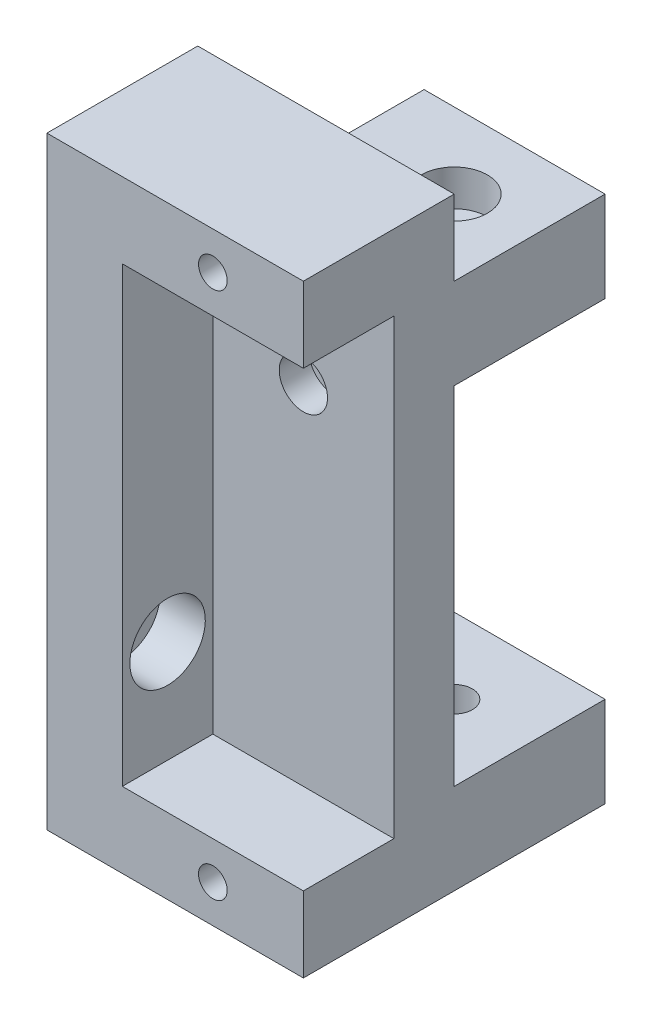
from build123d import *

# Parameters (mm, degrees)
ESQUISSE1_W                                       = 12
ESQUISSE1_H                                       = 40
BOSS_EXTRU_1_DEPTH                                = 4
ESQUISSE2_W                                       = 12
ESQUISSE2_H                                       = 6
BOSS_EXTRU_2_DEPTH                                = 10
ESQUISSE3_R                                       = 1.6
ENL_V_MAT_EXTRU_1_DEPTH                           = 2
ESQUISSE4_W                                       = 12
ESQUISSE4_H                                       = 5
BOSS_EXTRU_3_DEPTH                                = 6
ESQUISSE5_R                                       = 0.95
ENL_V_MAT_EXTRU_2_DEPTH                           = 5
ESQUISSE6_W                                       = 10
ESQUISSE6_H                                       = 40
BOSS_EXTRU_4_DEPTH                                = 5
ESQUISSE7_R                                       = 2.5
ENL_V_MAT_EXTRU_3_DEPTH                           = 3
CHAMBRAGE_POUR_VIS_SIX_PANS_CREUX_M21_D           = 2.4
CHAMBRAGE_POUR_VIS_SIX_PANS_CREUX_M21_DEPTH       = 6
CHAMBRAGE_POUR_VIS_SIX_PANS_CREUX_M21_CBORE_D     = 4.4
CHAMBRAGE_POUR_VIS_SIX_PANS_CREUX_M21_CBORE_DEPTH = 2.4


with BuildPart() as part:
    # Esquisse1 → Boss.-Extru.1 (new body)
    with BuildSketch(Plane.XY):
        with Locations((4, 2.5)):
            Rectangle(ESQUISSE1_W, ESQUISSE1_H)
    extrude(amount=BOSS_EXTRU_1_DEPTH)

    # Esquisse2 → Boss.-Extru.2 (add)
    with BuildSketch(Plane(origin=(0, 0, 0), x_dir=(-1, 0, 0), z_dir=(0, 0, -1))):
        with Locations((-4, -14.5)):
            Rectangle(ESQUISSE2_W, ESQUISSE2_H)
    boss_extru_2 = extrude(amount=BOSS_EXTRU_2_DEPTH)

    # Symétrie1: Boss.-Extru.2 across plane
    add(boss_extru_2.mirror(Plane.ZX))

    # Esquisse3 → Enlèv. mat.-Extru.1 (cut)
    with BuildSketch(Plane.XY.offset(4)):
        with Locations((4, 10.6)):
            Circle(ESQUISSE3_R)
    extrude(amount=-ENL_V_MAT_EXTRU_1_DEPTH, mode=Mode.SUBTRACT)

    # Esquisse4 → Boss.-Extru.3 (add)
    with BuildSketch(Plane.XY.offset(4)):
        with Locations((4, 20)):
            Rectangle(ESQUISSE4_W, ESQUISSE4_H)
        with Locations((4, -15)):
            Rectangle(ESQUISSE4_W, ESQUISSE4_H)
    extrude(amount=BOSS_EXTRU_3_DEPTH)

    # Esquisse5 → Enlèv. mat.-Extru.2 (cut)
    with BuildSketch(Plane.XY.offset(10)):
        with Locations((4, -15)):
            Circle(ESQUISSE5_R)
        with Locations(Location((4, 20, 0), (0, 0, 180))):
            Circle(ESQUISSE5_R)
    extrude(amount=-ENL_V_MAT_EXTRU_2_DEPTH, mode=Mode.SUBTRACT)

    # Esquisse6 → Boss.-Extru.4 (add)
    with BuildSketch(Plane.ZY.offset(2)):
        with Locations((5, 2.5)):
            Rectangle(ESQUISSE6_W, ESQUISSE6_H)
    extrude(amount=BOSS_EXTRU_4_DEPTH)

    # Esquisse7 → Enlèv. mat.-Extru.3 (cut)
    with BuildSketch(Plane(origin=(-2, 0, 0), x_dir=(0, 0, -1), z_dir=(1, 0, 0))):
        with Locations(Location((-7, -5.7, 0), (0, 0, 90))):
            Circle(ESQUISSE7_R)
    extrude(amount=-ENL_V_MAT_EXTRU_3_DEPTH, mode=Mode.SUBTRACT)

    # Chambrage pour vis à six pans creux M21
    with Locations(Plane(origin=(0, -17.5, 0), x_dir=(-1, 0, 0), z_dir=(0, -1, 0))):
        with Locations((-5, 5)):
            chambrage_pour_vis_six_pans_creux_m21 = CounterBoreHole(CHAMBRAGE_POUR_VIS_SIX_PANS_CREUX_M21_D / 2, CHAMBRAGE_POUR_VIS_SIX_PANS_CREUX_M21_CBORE_D / 2, CHAMBRAGE_POUR_VIS_SIX_PANS_CREUX_M21_CBORE_DEPTH, depth=CHAMBRAGE_POUR_VIS_SIX_PANS_CREUX_M21_DEPTH)

    # Symétrie2: Chambrage pour vis à six pans creux M21 across plane
    add(chambrage_pour_vis_six_pans_creux_m21.mirror(Plane.ZX), mode=Mode.SUBTRACT)


solid = part.part
